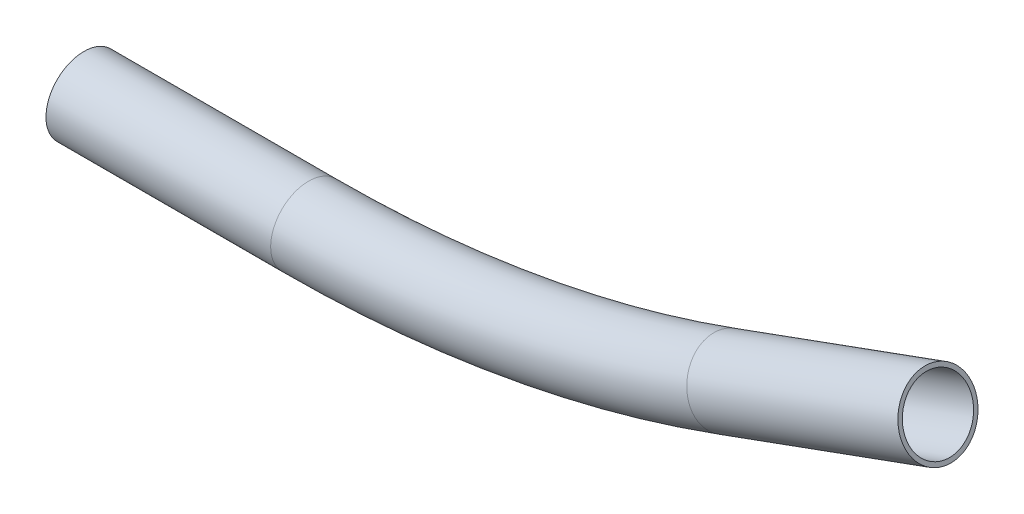
from build123d import *

# Parameters (mm, degrees)
SKETCH2_R   = 85.725
SKETCH2_R_2 = 76.2


with BuildPart() as part:
    # Sweep1: sweep along a path in Sketch1
    with BuildLine(Plane.XY) as sweep1_path:
        Line((1931.081806756, 340.501824486), (1453.717955396, 166.755591677))
        ThreePointArc((1453.717955396, 166.755591677), (988.153589624, 42.007995843), (508, 0))
        Line((508, 0), (0, 0))
    # Sketch2 → Sweep1 (sweep)
    with BuildSketch(Plane(origin=(0, 0, 0), x_dir=(0, 0, -1), z_dir=(1, 0, 0))):
        Circle(SKETCH2_R)
        Circle(SKETCH2_R_2, mode=Mode.SUBTRACT)
    sweep(path=sweep1_path.line)


solid = part.part
